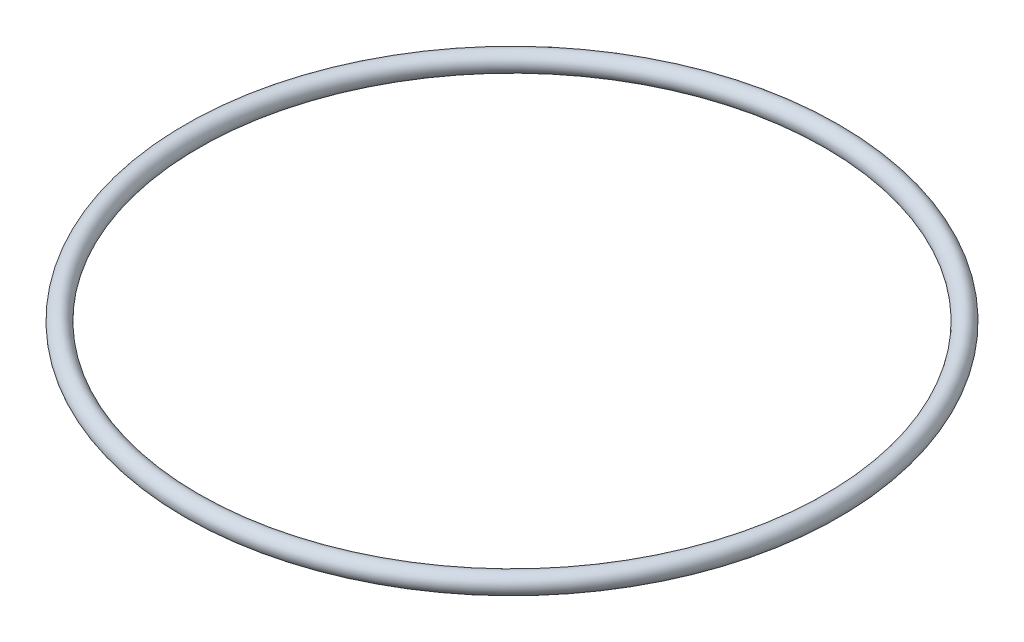
from build123d import *

# Parameters (mm, degrees)
ESQUISSE1_R = 10


with BuildPart() as part:
    # Esquisse1 → Révolution1 (revolve)
    with BuildSketch(Plane.XY, mode=Mode.PRIVATE) as r_volution1_sk:
        Circle(ESQUISSE1_R)
    revolve(r_volution1_sk.sketch.rotate(Axis((-336, 0, 0), (0, 1, 0)), 90), axis=Axis((-336, 0, 0), (0, 1, 0)))


solid = part.part
